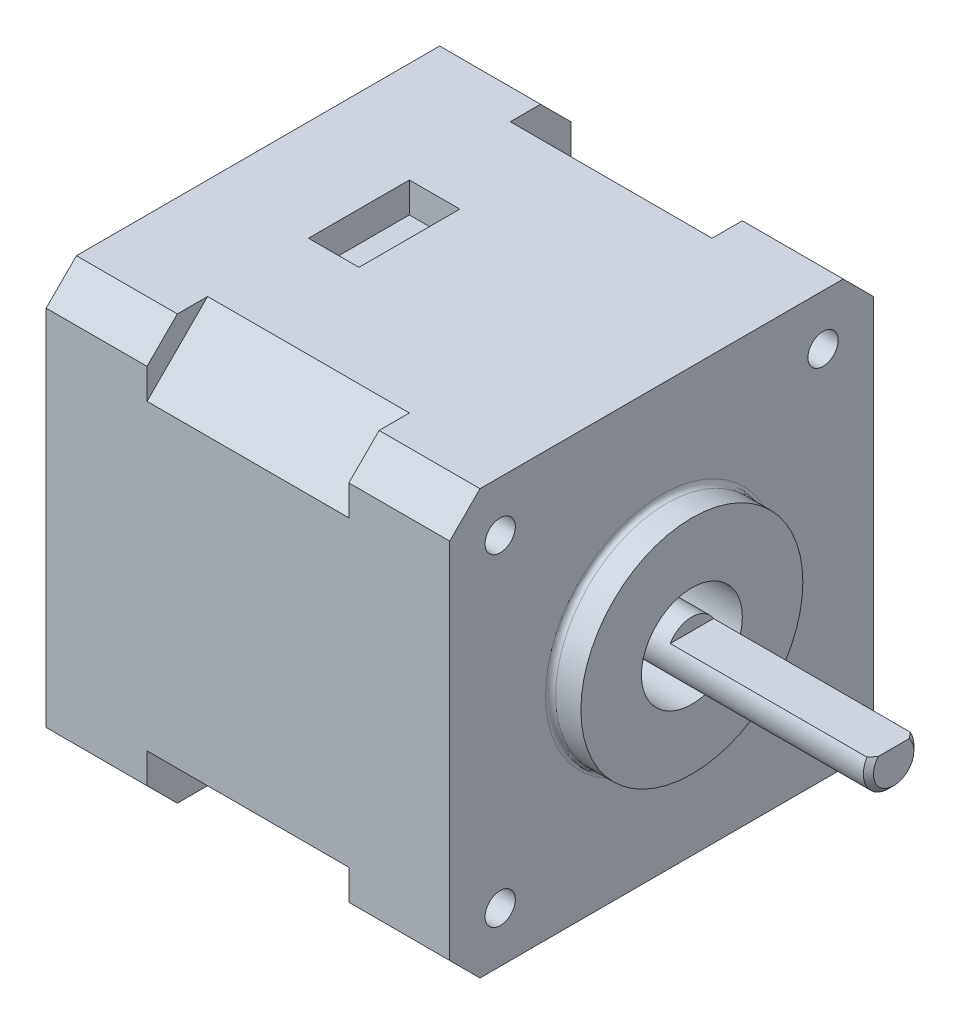
from build123d import *

# Parameters (mm, degrees)
BOSS_EXTRU_1_DEPTH      = 10
ESQUISSE2_W             = 42
ESQUISSE2_H             = 42
BOSS_EXTRU_2_DEPTH      = 10
ESQUISSE3_W             = 42
ESQUISSE3_H             = 42
BOSS_EXTRU_3_DEPTH      = 10
ESQUISSE4_R             = 11
BOSS_EXTRU_4_DEPTH      = 3
CONG_1_R                = 0.5
ESQUISSE5_R             = 5
ENL_V_MAT_EXTRU_1_DEPTH = 10
ESQUISSE6_R             = 2.5
BOSS_EXTRU_5_DEPTH      = 30
ENL_V_START             = -20
ENL_V_MAT_EXTRU_2_DEPTH = 20
CHANFREIN1_SIZE         = 0.5
ESQUISSE8_R             = 1.5
ENL_V_MAT_EXTRU_3_DEPTH = 5
ENL_V_MAT_EXTRU_5_DEPTH = 72.61005516
ESQUISSE11_W            = 5
ESQUISSE11_H            = 10
ENL_V_MAT_EXTRU_6_DEPTH = 3


with BuildPart() as part:
    # Esquisse1 → Boss.-Extru.1 (new, symmetric)
    with BuildSketch(Plane(origin=(0, 0, 0), x_dir=(0, 0, -1), z_dir=(1, 0, 0))):
        Polygon((6, 0), (36, 0), (42, -6), (42, -36), (36, -42), (6, -42), (0, -36), (0, -6), align=None)
    extrude(amount=BOSS_EXTRU_1_DEPTH, both=True)

    # Esquisse2 → Boss.-Extru.2 (add)
    with BuildSketch(Plane(origin=(10, 0, 0), x_dir=(0, 0, -1), z_dir=(1, 0, 0))):
        with Locations((21, -21)):
            Rectangle(ESQUISSE2_W, ESQUISSE2_H)
    extrude(amount=BOSS_EXTRU_2_DEPTH)

    # Esquisse3 → Boss.-Extru.3 (add)
    with BuildSketch(Plane.ZY.offset(10)):
        with Locations((-21, -21)):
            Rectangle(ESQUISSE3_W, ESQUISSE3_H)
    extrude(amount=BOSS_EXTRU_3_DEPTH)

    # Esquisse4 → Boss.-Extru.4 (add)
    with BuildSketch(Plane(origin=(20, 0, 0), x_dir=(0, 0, -1), z_dir=(1, 0, 0))):
        with Locations((21, -21)):
            Circle(ESQUISSE4_R)
    extrude(amount=BOSS_EXTRU_4_DEPTH)

    # Congé1
    cong_1_edges = [part.edges().sort_by_distance(p)[0] for p in [
        (20, -21, -10),
    ]]
    fillet(cong_1_edges, radius=CONG_1_R)

    # Esquisse5 → Enlèv. mat.-Extru.1 (cut)
    with BuildSketch(Plane(origin=(23, 0, 0), x_dir=(0, 0, -1), z_dir=(1, 0, 0))):
        with Locations((21, -21)):
            Circle(ESQUISSE5_R)
    extrude(amount=-ENL_V_MAT_EXTRU_1_DEPTH, mode=Mode.SUBTRACT)

    # Esquisse6 → Boss.-Extru.5 (add)
    with BuildSketch(Plane(origin=(13, 0, 0), x_dir=(0, 0, -1), z_dir=(1, 0, 0))):
        with Locations((21, -21)):
            Circle(ESQUISSE6_R)
    extrude(amount=BOSS_EXTRU_5_DEPTH)

    # Esquisse7 → Enlèv. mat.-Extru.2 (cut)
    with BuildSketch(Plane(origin=(43, 0, 0), x_dir=(0, 0, -1), z_dir=(1, 0, 0)).offset(ENL_V_START)):
        with BuildLine():
            Line((18.853641827, -19.718147202), (23.146358173, -19.718147202))
            ThreePointArc((23.146358173, -19.718147202), (21, -18.5), (18.853641827, -19.718147202))
        make_face()
    extrude(amount=ENL_V_MAT_EXTRU_2_DEPTH, mode=Mode.SUBTRACT)

    # Chanfrein1
    chanfrein1_edges = [part.edges().sort_by_distance(p)[0] for p in [
        (43, -23.409968406, -20.335129874),
    ]]
    chamfer(chanfrein1_edges, length=CHANFREIN1_SIZE)

    # Esquisse8 → Enlèv. mat.-Extru.3 (cut)
    with BuildSketch(Plane(origin=(20, 0, 0), x_dir=(0, 0, -1), z_dir=(1, 0, 0))):
        with Locations((5, -5)):
            Circle(ESQUISSE8_R)
        with Locations(Location((37, -5, 0), (0, 0, 180))):
            Circle(ESQUISSE8_R)
        with Locations(Location((5, -37, 0), (0, 0, 180))):
            Circle(ESQUISSE8_R)
        with Locations((37, -37)):
            Circle(ESQUISSE8_R)
    extrude(amount=-ENL_V_MAT_EXTRU_3_DEPTH, mode=Mode.SUBTRACT)

    # Esquisse9 → Enlèv. mat.-Extru.5 (cut, through all)
    with BuildSketch(Plane(origin=(20, 0, 0), x_dir=(0, 0, -1), z_dir=(1, 0, 0))):
        Polygon((3, 0), (0, -3), (0, 0), align=None)
        Polygon((39, 0), (42, -3), (42, 0), align=None)
        Polygon((3, -42), (0, -39), (0, -42), align=None)
        Polygon((39, -42), (42, -39), (42, -42), align=None)
    extrude(amount=-ENL_V_MAT_EXTRU_5_DEPTH, mode=Mode.SUBTRACT)

    # Esquisse11 → Enlèv. mat.-Extru.6 (cut)
    with BuildSketch(Plane(origin=(0, 0, 0), x_dir=(1, 0, 0), z_dir=(0, 1, 0))):
        with Locations((-7.5, 21)):
            Rectangle(ESQUISSE11_W, ESQUISSE11_H)
    extrude(amount=-ENL_V_MAT_EXTRU_6_DEPTH, mode=Mode.SUBTRACT)


solid = part.part
